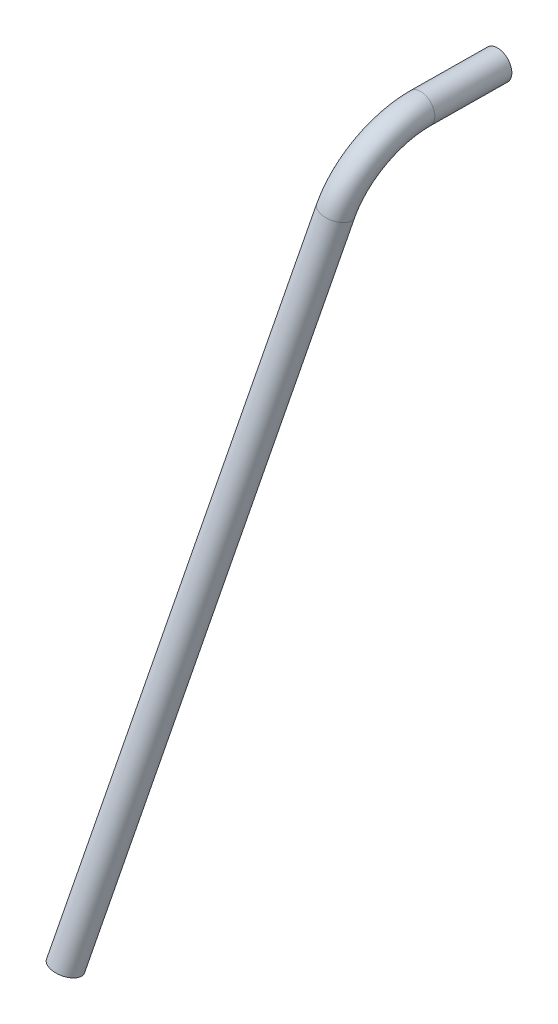
from build123d import *

# Parameters (mm, degrees)
SWEEP1_PROFILE_R     = 7.14375
CUT_SWEEP1_PROFILE_R = 3.175


with BuildPart() as part:
    # Sweep1: sweep along a curve in space
    with BuildLine() as sweep1_path:
        Line((224.137929309, 49.848561855, -283.646589392), (167.414472369, -265.92667479, -205.540959925))
        ThreePointArc((229.539261293, 78.431978162, -320.668414257), (227.913813432, 70.452844404, -297.126886703), (224.137929309, 49.848561855, -283.646589392))
        Line((229.539261293, 78.431978162, -320.668414257), (229.867507635, 78.369118621, -358.766948389))
    # Sweep1 profile (on start of the path) → Sweep1 (sweep)
    with BuildSketch(Plane(origin=(229.867507635, 78.369118621, -358.766948389), x_dir=(0.9999628867418414, 0, 0.008615401263049256), z_dir=(-0.008615389537362954, 0.0016498567235910635, 0.9999615257778227))):
        Circle(SWEEP1_PROFILE_R)
    sweep(path=sweep1_path.line)

    # Cut-Sweep1: sweep along a curve in space
    with BuildLine() as cut_sweep1_path:
        Line((224.137929309, 49.848561855, -283.646589392), (167.414472369, -265.92667479, -205.540959925))
        ThreePointArc((229.539261293, 78.431978162, -320.668414257), (227.913813432, 70.452844404, -297.126886703), (224.137929309, 49.848561855, -283.646589392))
        Line((229.539261293, 78.431978162, -320.668414257), (229.867507635, 78.369118621, -358.766948389))
    # Cut-Sweep1 profile (on start of the path) → Cut-Sweep1 (sweep, cut)
    with BuildSketch(Plane(origin=(229.867507635, 78.369118621, -358.766948389), x_dir=(0.9999628867418414, 0, 0.008615401263049256), z_dir=(-0.008615389537362954, 0.0016498567235910635, 0.9999615257778227))):
        Circle(CUT_SWEEP1_PROFILE_R)
    sweep(path=cut_sweep1_path.line, mode=Mode.SUBTRACT)


solid = part.part
